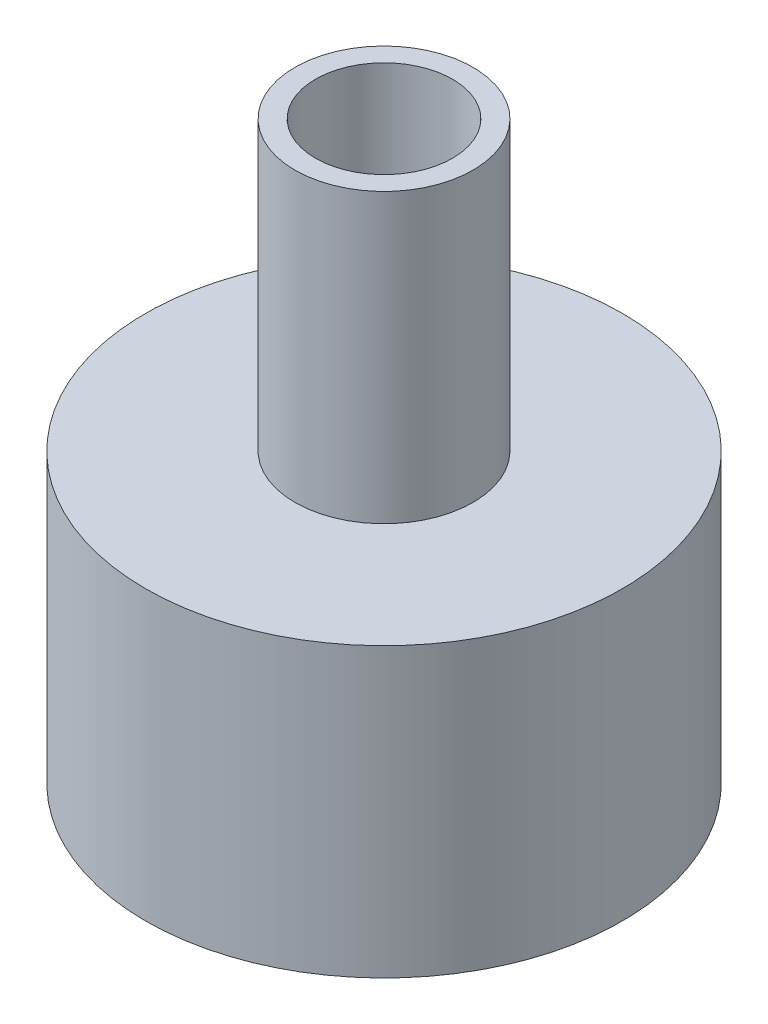
from build123d import *

# Parameters (mm, degrees)
SKETCH2_R           = 1.74
BOSS_EXTRUDE1_DEPTH = 2.1
SKETCH3_R           = 0.65
BOSS_EXTRUDE2_DEPTH = 2.1
SKETCH4_R           = 0.5
CUT_EXTRUDE1_DEPTH  = 3.85


with BuildPart() as part:
    # Sketch2 → Boss-Extrude1 (new body)
    with BuildSketch(Plane(origin=(0, 0, 0), x_dir=(1, 0, 0), z_dir=(0, 1, 0))):
        with Locations(Location((0, 0, 0), (0, 0, 270))):
            Circle(SKETCH2_R)
    extrude(amount=BOSS_EXTRUDE1_DEPTH)

    # Sketch3 → Boss-Extrude2 (add)
    with BuildSketch(Plane(origin=(0, 2.1, 0), x_dir=(1, 0, 0), z_dir=(0, 1, 0))):
        with Locations(Location((0, 0, 0), (0, 0, 270))):
            Circle(SKETCH3_R)
    extrude(amount=BOSS_EXTRUDE2_DEPTH)

    # Sketch4 → Cut-Extrude1 (cut)
    with BuildSketch(Plane(origin=(0, 4.2, 0), x_dir=(1, 0, 0), z_dir=(0, 1, 0))):
        with Locations(Location((0, 0, 0), (0, 0, 270))):
            Circle(SKETCH4_R)
    extrude(amount=-CUT_EXTRUDE1_DEPTH, mode=Mode.SUBTRACT)


solid = part.part
